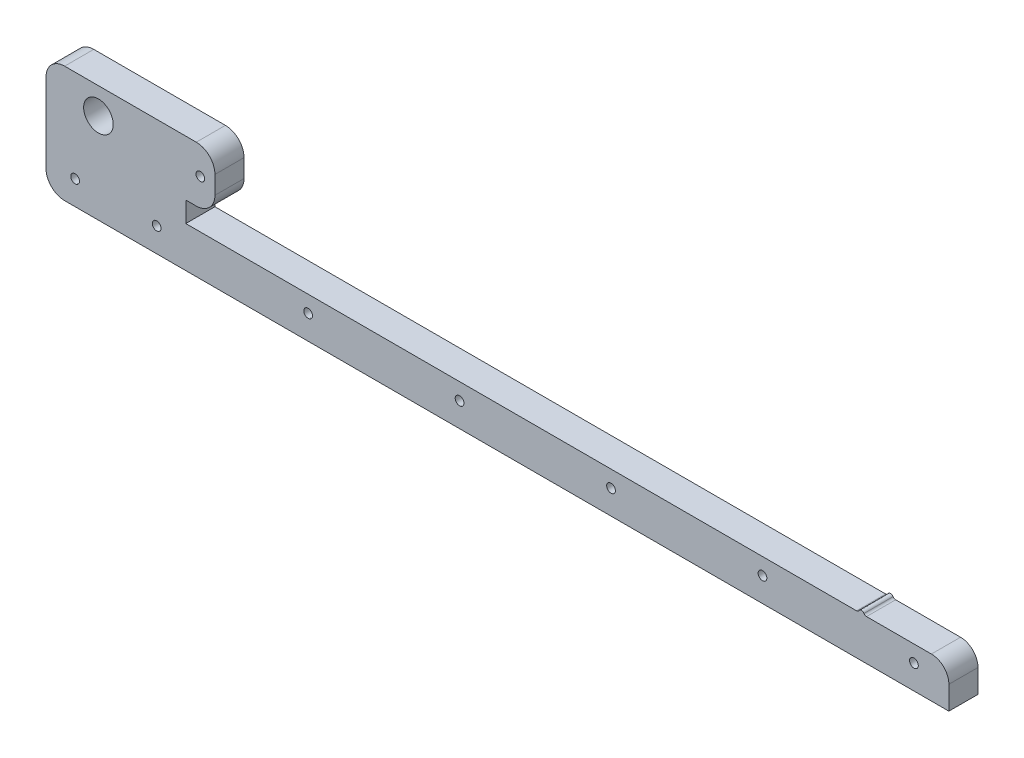
from build123d import *

# Parameters (mm, degrees)
DODANIE_WYCI_GNI_CIE1_DEPTH = 10
SZKIC2_R                    = 1.5
WYTNIJ_WYCI_GNI_CIE1_DEPTH  = 10
SZKIC5_R                    = 5.075
WYTNIJ_WYCI_GNI_CIE2_DEPTH  = 10
WYTNIJ_WYCI_GNI_CIE3_DEPTH  = 10
DODANIE_WYCI_GNI_CIE2_DEPTH = 10


with BuildPart() as part:
    # Szkic1 → Dodanie-wyciągnięcie1 (new body)
    with BuildSketch(Plane.XY):
        with BuildLine():
            Line((656.238844698, -438.745595983), (352.638844698, -438.745595983))
            ThreePointArc((352.638844698, -438.745595983), (348.113361298, -436.871079382), (346.238844698, -432.345595983))
            Line((346.238844698, -432.345595983), (346.238844698, -405.145595983))
            ThreePointArc((346.238844698, -405.145595983), (348.113361298, -400.620112583), (352.638844698, -398.745595983))
            Line((352.638844698, -398.745595983), (394.238844698, -398.745595983))
            Line((394.238844698, -398.745595983), (397.838844698, -398.745595983))
            ThreePointArc((397.838844698, -398.745595983), (402.364328097, -400.620112583), (404.238844698, -405.145595983))
            Line((404.238844698, -405.145595983), (404.238844698, -411.345595983))
            ThreePointArc((404.238844698, -411.345595983), (402.364328097, -415.871079382), (397.838844698, -417.745595983))
            Line((397.838844698, -417.745595983), (394.238844698, -417.745595983))
            Line((394.238844698, -417.745595983), (394.238844698, -424.745595983))
            Line((394.238844698, -424.745595983), (656.238844698, -424.745595983))
            Line((656.238844698, -424.745595983), (656.238844698, -438.745595983))
        make_face()
    extrude(amount=DODANIE_WYCI_GNI_CIE1_DEPTH)

    # Szkic2 → Wytnij-wyciągnięcie1 (cut)
    with BuildSketch(Plane.XY.offset(10)):
        with Locations((644.238844698, -430.4368906)):
            Circle(SZKIC2_R)
        with Locations((592.238844698, -430.4368906)):
            Circle(SZKIC2_R)
        with Locations((540.238844698, -430.4368906)):
            Circle(SZKIC2_R)
        with Locations((488.238844698, -430.4368906)):
            Circle(SZKIC2_R)
        with Locations((436.238844698, -430.4368906)):
            Circle(SZKIC2_R)
        with Locations((384.238844698, -430.4368906)):
            Circle(SZKIC2_R)
        with Locations((356.238844698, -430.4368906)):
            Circle(SZKIC2_R)
        with Locations((399.238844698, -408.245595983)):
            Circle(SZKIC2_R)
    extrude(amount=-WYTNIJ_WYCI_GNI_CIE1_DEPTH, mode=Mode.SUBTRACT)

    # Szkic5 → Wytnij-wyciągnięcie2 (cut)
    with BuildSketch(Plane(origin=(0, 0, 0), x_dir=(-1, 0, 0), z_dir=(0, 0, -1))):
        with Locations((-364.238844698, -407.745595983)):
            Circle(SZKIC5_R)
    extrude(amount=-WYTNIJ_WYCI_GNI_CIE2_DEPTH, mode=Mode.SUBTRACT)

    # Szkic6 → Wytnij-wyciągnięcie3 (cut)
    with BuildSketch(Plane(origin=(0, 0, 0), x_dir=(-1, 0, 0), z_dir=(0, 0, -1))):
        with BuildLine():
            Line((-656.238844698, -430.745595983), (-656.238844698, -424.745595983))
            Line((-656.238844698, -424.745595983), (-650.238844698, -424.745595983))
            ThreePointArc((-650.238844698, -424.745595983), (-654.481485385, -426.502955296), (-656.238844698, -430.745595983))
        make_face()
    extrude(amount=-WYTNIJ_WYCI_GNI_CIE3_DEPTH, mode=Mode.SUBTRACT)

    # Szkic7 → Dodanie-wyciągnięcie2 (add)
    with BuildSketch(Plane.XY.offset(10)):
        with BuildLine():
            Line((624.50679389, -424.745595983), (627.970895505, -424.745595983))
            ThreePointArc((627.970895505, -424.745595983), (627.470895505, -424.611621386), (627.104870102, -424.245595983))
            ThreePointArc((627.104870102, -424.245595983), (626.238844698, -423.745595983), (625.372819294, -424.245595983))
            ThreePointArc((625.372819294, -424.245595983), (625.00679389, -424.611621386), (624.50679389, -424.745595983))
        make_face()
    extrude(amount=-DODANIE_WYCI_GNI_CIE2_DEPTH)


solid = part.part
